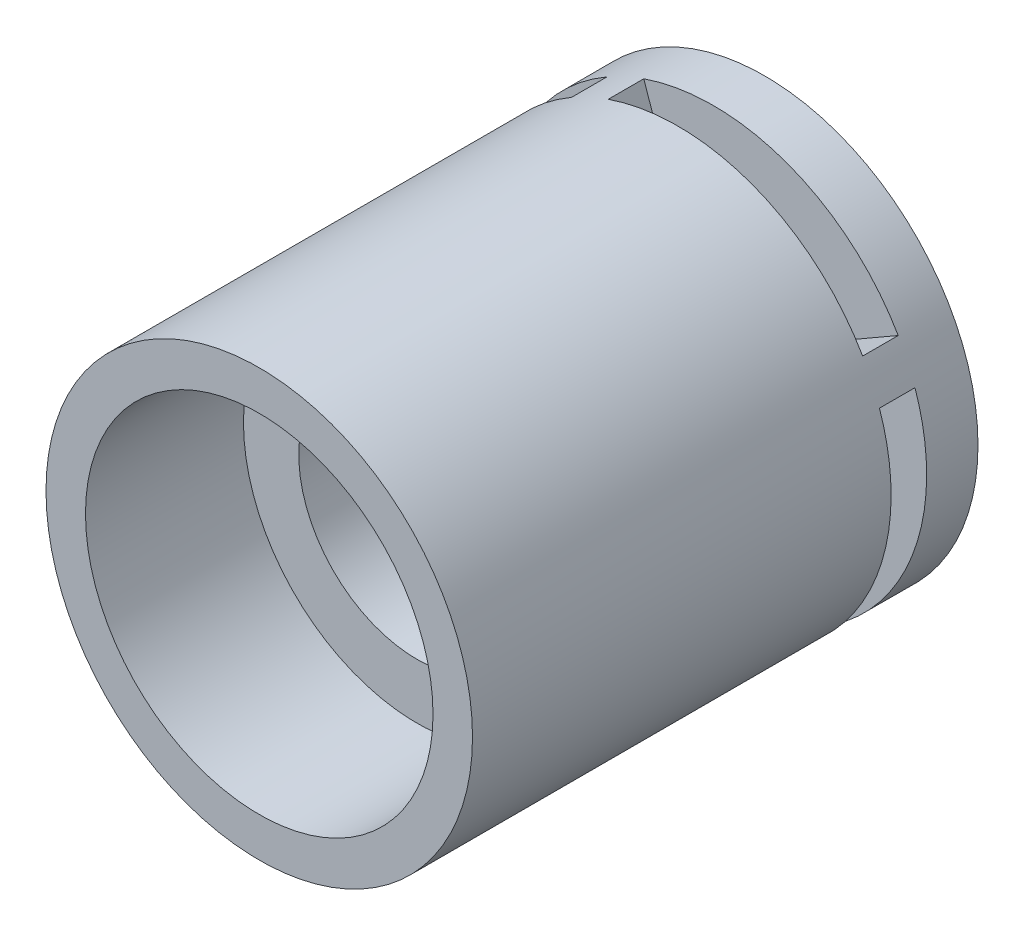
from build123d import *

# Parameters (mm, degrees)
SKETCH2_R           = 13.5
BOSS_EXTRUDE1_DEPTH = 32
SKETCH4_R           = 11
CUT_EXTRUDE1_DEPTH  = 10
SKETCH5_R           = 7.5
CUT_EXTRUDE2_DEPTH  = 30
WRAP1_SECTION_W     = 12
WRAP1_SECTION_H     = 2.25
WRAP1_ANGLE         = 79.123349442
CIRPATTERN1_COUNT   = 4


with BuildPart() as part:
    # Sketch2 → Boss-Extrude1 (new body)
    with BuildSketch(Plane.XY):
        Circle(SKETCH2_R)
    extrude(amount=-BOSS_EXTRUDE1_DEPTH)

    # Sketch4 → Cut-Extrude1 (cut)
    with BuildSketch(Plane.XY):
        Circle(SKETCH4_R)
    extrude(amount=-CUT_EXTRUDE1_DEPTH, mode=Mode.SUBTRACT)

    # Sketch5 → Cut-Extrude2 (cut)
    with BuildSketch(Plane.XY):
        Circle(SKETCH5_R)
    extrude(amount=-CUT_EXTRUDE2_DEPTH, mode=Mode.SUBTRACT)

    # Wrap1 section (on wrap section) → Wrap1 (revolve, cut)
    with BuildSketch(Plane(origin=(0, 0, 0), x_dir=(0.8665623942609315, 0.4990687496255019, 0), z_dir=(0.4990687496255019, -0.8665623942609315, 0))):
        with Locations((7.5, -27.625)):
            Rectangle(WRAP1_SECTION_W, WRAP1_SECTION_H)
    wrap1 = revolve(axis=Axis((0, 0, 0), (0, 0, 1)), revolution_arc=WRAP1_ANGLE, mode=Mode.SUBTRACT)

    # CirPattern1: Wrap1 ×4 about axis
    cirpattern1_axis = Axis((0, 0, -32), (0, 0, 1))
    for i in range(1, CIRPATTERN1_COUNT):
        add(wrap1.rotate(cirpattern1_axis, i * 360 / CIRPATTERN1_COUNT), mode=Mode.SUBTRACT)


solid = part.part
